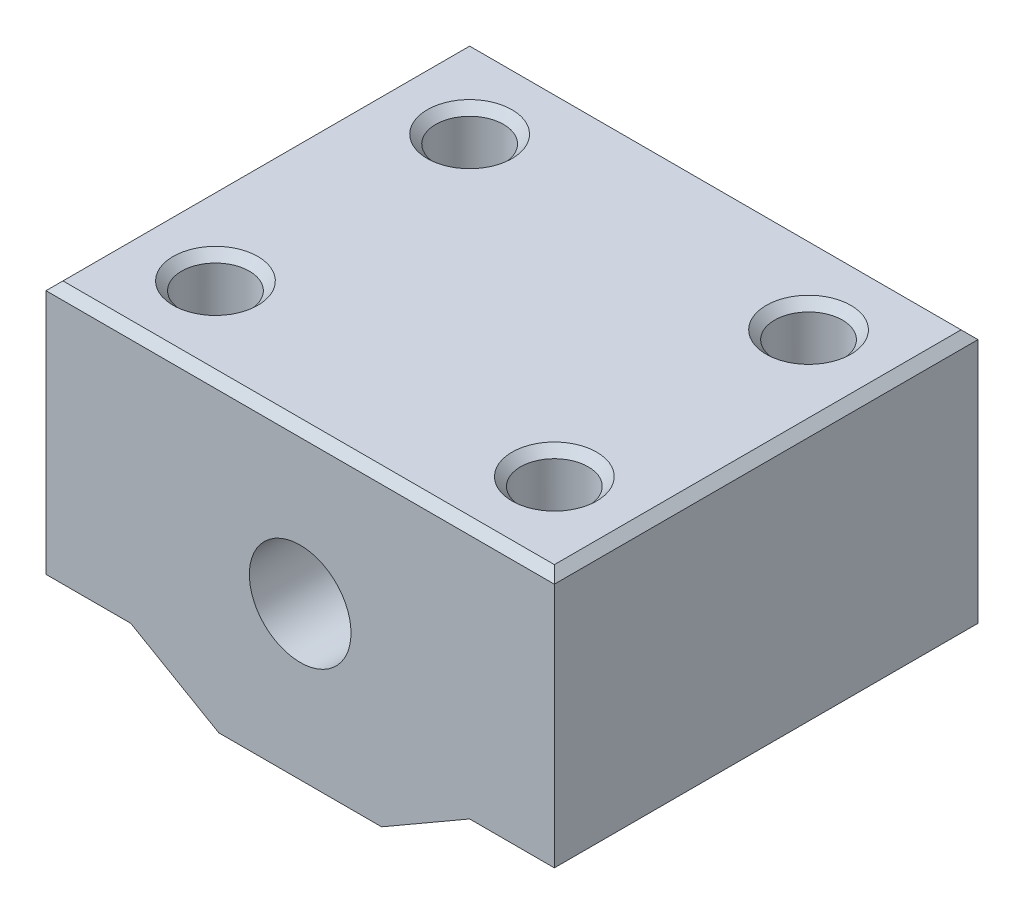
from build123d import *

# Parameters (mm, degrees)
EXTRUDE_1_DEPTH     = 25
SKETCH_2_R          = 2
CUT_EXTRUDE_1_DEPTH = 35.263683398
SKETCH_3_R          = 3
CUT_EXTRUDE_2_DEPTH = 31.987900865
CHAMFER_1_SIZE      = 0.5


with BuildPart() as part:
    # 스케치1 → 보스-돌출1 (new body)
    with BuildSketch(Plane.XY):
        Polygon((-15, -7.5), (-10, -7.5), (-4.803847577, -10.5), (4.803847577, -10.5), (10, -7.5), (15, -7.5), (15, 7.5), (-15, 7.5), align=None)
    extrude(amount=EXTRUDE_1_DEPTH)

    # 스케치2 → 컷-돌출1 (cut, through all)
    with BuildSketch(Plane(origin=(0, 7.5, 0), x_dir=(1, 0, 0), z_dir=(0, 1, 0))):
        with Locations(Location((-10, -5, 0), (0, 0, 270))):
            Circle(SKETCH_2_R)
        with Locations(Location((-10, -20, 0), (0, 0, 270))):
            Circle(SKETCH_2_R)
        with Locations(Location((10, -20, 0), (0, 0, 270))):
            Circle(SKETCH_2_R)
        with Locations(Location((10, -5, 0), (0, 0, 270))):
            Circle(SKETCH_2_R)
    extrude(amount=-CUT_EXTRUDE_1_DEPTH, mode=Mode.SUBTRACT)

    # 스케치3 → 컷-돌출2 (cut, through all)
    with BuildSketch(Plane.XY.offset(25)):
        with Locations((0, -1.5)):
            Circle(SKETCH_3_R)
    extrude(amount=-CUT_EXTRUDE_2_DEPTH, mode=Mode.SUBTRACT)

    # 모따기1
    chamfer_1_edges = [part.edges().sort_by_distance(p)[0] for p in [
        (0, 7.5, 0),
        (-15, 7.5, 12.5),
        (15, 7.5, 12.5),
        (-10, 7.5, 3),
        (-10, 7.5, 18),
        (10, 7.5, 18),
        (10, 7.5, 3),
        (0, 7.5, 25),
    ]]
    chamfer(chamfer_1_edges, length=CHAMFER_1_SIZE)


solid = part.part
